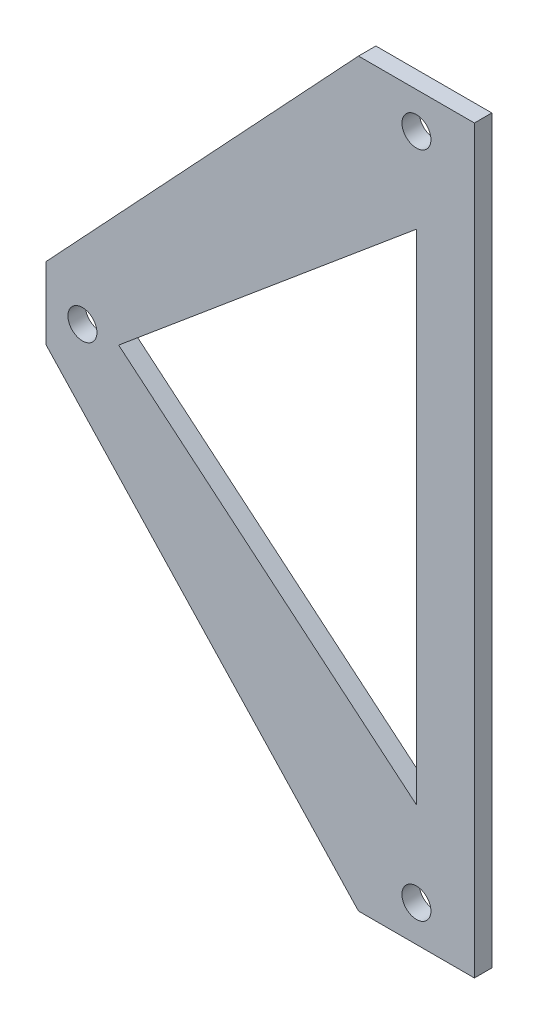
from build123d import *

# Parameters (mm, degrees)
SKETCH1_W             = 8
SKETCH1_H             = 5
SKETCH1_R             = 1
BOSS_EXTRUDE1_DEPTH   = 1.2
SKETCH1_W_2           = 5
BOSS_EXTRUDE1_2_DEPTH = 1.2
BOSS_EXTRUDE1_3_DEPTH = 1.2
SKETCH2_W             = 5
SKETCH2_H             = 5
SKETCH2_R             = 1
BOSS_EXTRUDE4_DEPTH   = 1.2


with BuildPart() as part:
    # Sketch1 → Boss-Extrude1 (new body)
    with BuildSketch(Plane.XY):
        with Locations((35.73242964, 79.160231922)):
            Rectangle(SKETCH1_W, SKETCH1_H)
        with Locations((35.73242964, 79.160231922)):
            Circle(SKETCH1_R, mode=Mode.SUBTRACT)
    extrude(amount=BOSS_EXTRUDE1_DEPTH)



with BuildPart() as body_2:
    # Sketch1 → Boss-Extrude1 2 (new body)
    with BuildSketch(Plane.XY):
        with Locations((12.68242964, 102.210231922)):
            Rectangle(SKETCH1_W_2, SKETCH1_H)
        with Locations((12.68242964, 102.210231922)):
            Circle(SKETCH1_R, mode=Mode.SUBTRACT)
    extrude(amount=BOSS_EXTRUDE1_2_DEPTH)


with BuildPart() as body_3:
    # Sketch1 → Boss-Extrude1 3 (new body)
    with BuildSketch(Plane.XY):
        with Locations((35.73242964, 125.260231922)):
            Rectangle(SKETCH1_W, SKETCH1_H)
        with Locations((35.73242964, 125.260231922)):
            Circle(SKETCH1_R, mode=Mode.SUBTRACT)
    extrude(amount=BOSS_EXTRUDE1_3_DEPTH)


with BuildPart() as part_1:
    add(part.part)

    add(body_2.part)  # Boss-Extrude4 merges body 2

    add(body_3.part)  # Boss-Extrude4 merges body 3
    # Sketch2 → Boss-Extrude4 (add)
    # profile 1 of 6: a face of its own
    with BuildSketch(Plane.XY.offset(1.2)):
        Polygon((15.18242964, 99.710231922), (10.18242964, 99.710231922), (31.73242964, 76.660231922), (31.73242964, 81.660231922), (35.73242964, 81.660231922), (35.73242964, 85.008500761), (15.18242964, 102.210231922), align=None)
    # profile 2 of 6: a face of its own
    with BuildSketch(Plane.XY.offset(1.2)):
        Polygon((31.73242964, 127.760231922), (10.18242964, 104.710231922), (15.18242964, 104.710231922), (15.18242964, 102.210231922), (35.73242964, 119.411963083), (35.73242964, 122.760231922), (31.73242964, 122.760231922), align=None)
    # profile 3 of 6: a face of its own
    with BuildSketch(Plane.XY.offset(1.2)):
        with Locations((12.68242964, 102.210231922)):
            Rectangle(SKETCH2_W, SKETCH2_H)
        with Locations((12.68242964, 102.210231922)):
            Circle(SKETCH2_R, mode=Mode.SUBTRACT)
    # profile 4 of 6: a face of its own
    with BuildSketch(Plane.XY.offset(1.2)):
        Polygon((35.73242964, 119.411963083), (35.73242964, 85.008500761), (39.73242964, 81.660231922), (39.73242964, 122.760231922), align=None)
    # profile 5 of 6: a face of its own
    with BuildSketch(Plane.XY.offset(1.2)):
        Polygon((35.73242964, 122.760231922), (35.73242964, 119.411963083), (39.73242964, 122.760231922), align=None)
    # profile 6 of 6: a face of its own
    with BuildSketch(Plane.XY.offset(1.2)):
        Polygon((35.73242964, 85.008500761), (35.73242964, 81.660231922), (39.73242964, 81.660231922), align=None)
    extrude(amount=-BOSS_EXTRUDE4_DEPTH)


solid = part_1.part
